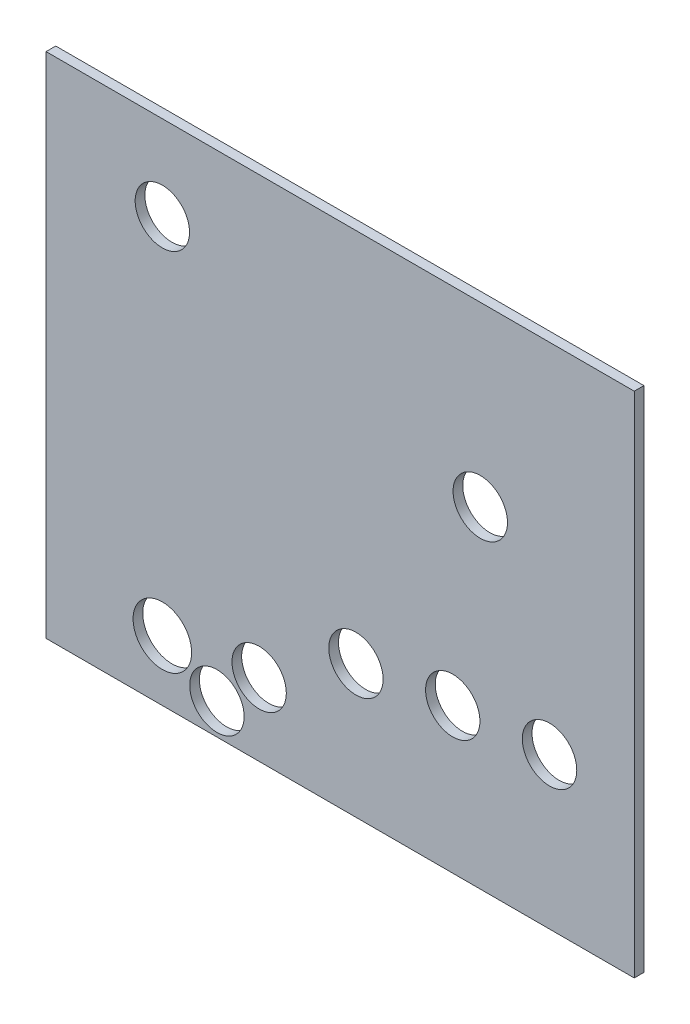
from build123d import *

# Parameters (mm, degrees)
SKETCH1_W           = 308.670974492
SKETCH1_H           = 266.7
SKETCH1_R           = 14.2875
SKETCH1_R_2         = 14.2621
SKETCH1_R_3         = 15.365901376
BOSS_EXTRUDE1_DEPTH = 5.08


with BuildPart() as part:
    # Sketch1 → Boss-Extrude1 (new body)
    with BuildSketch(Plane.XY):
        with Locations((-73.533038571, -40.364359579)):
            Rectangle(SKETCH1_W, SKETCH1_H)
        Circle(SKETCH1_R, mode=Mode.SUBTRACT)
        with Locations((-138.201859455, -157.325049094)):
            Circle(SKETCH1_R, mode=Mode.SUBTRACT)
        with Locations((-166.847551324, 48.535640421)):
            Circle(SKETCH1_R_2, mode=Mode.SUBTRACT)
        with Locations((-166.847551324, -141.964359579)):
            Circle(SKETCH1_R_3, mode=Mode.SUBTRACT)
        with Locations((-116.047551324, -135.614359579)):
            Circle(SKETCH1_R_2, mode=Mode.SUBTRACT)
        with Locations((-65.247551325, -103.864359579)):
            Circle(SKETCH1_R_2, mode=Mode.SUBTRACT)
        with Locations((-14.447551325, -97.514359579)):
            Circle(SKETCH1_R_2, mode=Mode.SUBTRACT)
        with Locations((36.352448675, -94.389320601)):
            Circle(SKETCH1_R, mode=Mode.SUBTRACT)
    extrude(amount=BOSS_EXTRUDE1_DEPTH)


solid = part.part
